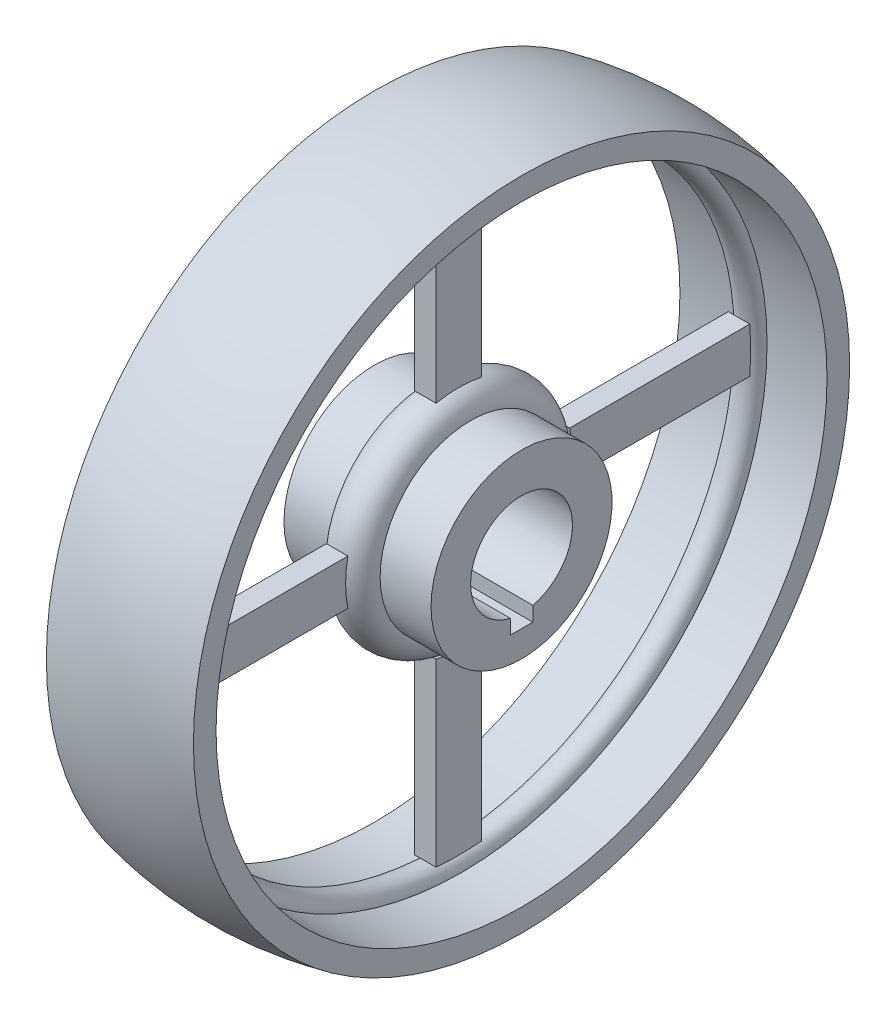
from build123d import *

# Parameters (mm, degrees)
SKETCH2_R               = 129
SKETCH2_R_2             = 50
BOSS_EXTRUDE1_DEPTH     = 4.75
CUT_EXTRUDE5_DEPTH      = 160
CUT_EXTRUDE5_DEPTH_BACK = 138
SKETCH6_R               = 22.5
CUT_EXTRUDE6_DEPTH      = 138
SKETCH7_W               = 9.947014286
SKETCH7_H               = 11.780873212
CUT_EXTRUDE7_DEPTH      = 138


with BuildPart() as part:
    # Sketch1 → Revolve1 (revolve)
    with BuildSketch(Plane.XY, mode=Mode.PRIVATE) as revolve1_sk:
        with BuildLine():
            Line((-32.5, 10), (32.5, 10))
            Line((32.5, 10), (32.5, 40))
            Line((32.5, 40), (10, 40))
            ThreePointArc((10, 40), (0, 50), (-10, 40))
            Line((-10, 40), (-32.5, 40))
            Line((-32.5, 40), (-32.5, 10))
        make_face()
        with BuildLine():
            Line((-32.5, 135), (-6, 135))
            ThreePointArc((-6, 135), (0, 129), (6, 135))
            Line((6, 135), (32.5, 135))
            Line((32.5, 135), (32.5, 145))
            ThreePointArc((32.5, 145), (0, 148.597611017), (-32.5, 145))
            Line((-32.5, 145), (-32.5, 135))
        make_face()
    revolve(revolve1_sk.sketch.rotate(Axis((-46.335135684, 0, 0), (1, 0, 0)), 90), axis=Axis((-46.335135684, 0, 0), (1, 0, 0)))

    # Sketch6 → Cut-Extrude6 (cut)
    with BuildSketch(Plane(origin=(32.5, 0, 0), x_dir=(0, 0, -1), z_dir=(1, 0, 0))):
        Circle(SKETCH6_R)
    extrude(amount=-CUT_EXTRUDE6_DEPTH, mode=Mode.SUBTRACT)

    # Sketch7 → Cut-Extrude7 (cut)
    with BuildSketch(Plane(origin=(32.5, 0, 0), x_dir=(0, 0, -1), z_dir=(1, 0, 0))):
        with Locations((0, -22.5)):
            Rectangle(SKETCH7_W, SKETCH7_H)
    extrude(amount=-CUT_EXTRUDE7_DEPTH, mode=Mode.SUBTRACT)


with BuildPart() as body_2:
    # Sketch2 → Boss-Extrude1 (new, symmetric)
    with BuildSketch(Plane(origin=(0, 0, 0), x_dir=(0, 0, -1), z_dir=(1, 0, 0))):
        Circle(SKETCH2_R)
        Circle(SKETCH2_R_2, mode=Mode.SUBTRACT)
    extrude(amount=BOSS_EXTRUDE1_DEPTH, both=True)

    # Sketch3 → Cut-Extrude5 (cut, two sides: drawn at the far end of the back side and taken through both)
    with BuildSketch(Plane(origin=(4.75, 0, 0), x_dir=(0, 0, -1), z_dir=(1, 0, 0)).offset(-CUT_EXTRUDE5_DEPTH_BACK)):
        with BuildLine():
            Line((48.989794856, 10), (128.611819053, 10))
            ThreePointArc((128.611819053, 10), (91.216774773, 91.216774773), (10, 128.611819053))
            Line((10, 128.611819053), (10, 48.989794856))
            ThreePointArc((10, 48.989794856), (35.355339059, 35.355339059), (48.989794856, 10))
        make_face()
        with BuildLine():
            Line((-10, 48.989794856), (-10, 128.611819053))
            ThreePointArc((-10, 128.611819053), (-91.216774773, 91.216774773), (-128.611819053, 10))
            Line((-128.611819053, 10), (-48.989794856, 10))
            ThreePointArc((-48.989794856, 10), (-35.355339059, 35.355339059), (-10, 48.989794856))
        make_face()
        with BuildLine():
            Line((48.989794856, -10), (128.611819053, -10))
            ThreePointArc((128.611819053, -10), (91.216774773, -91.216774773), (10, -128.611819053))
            Line((10, -128.611819053), (10, -48.989794856))
            ThreePointArc((10, -48.989794856), (35.355339059, -35.355339059), (48.989794856, -10))
        make_face()
        with BuildLine():
            Line((-10, -48.989794856), (-10, -128.611819053))
            ThreePointArc((-10, -128.611819053), (-91.216774773, -91.216774773), (-128.611819053, -10))
            Line((-128.611819053, -10), (-48.989794856, -10))
            ThreePointArc((-48.989794856, -10), (-35.355339059, -35.355339059), (-10, -48.989794856))
        make_face()
    extrude(amount=CUT_EXTRUDE5_DEPTH + CUT_EXTRUDE5_DEPTH_BACK, mode=Mode.SUBTRACT)


with BuildPart() as cut_extrude5_piece_1:
    # of the separate pieces the step leaves, piece 1, a body of its own (cut_extrude5_pieces)
    add(body_2.part.solids().sort_by_distance((4.75, 10, -128.611819053))[0])


with BuildPart() as cut_extrude5_piece_2:
    # of the separate pieces the step leaves, piece 2, a body of its own (cut_extrude5_pieces)
    add(body_2.part.solids().sort_by_distance((4.75, 128.611819053, -10))[0])


with BuildPart() as cut_extrude5_piece_3:
    # of the separate pieces the step leaves, piece 3, a body of its own (cut_extrude5_pieces)
    add(body_2.part.solids().sort_by_distance((-4.75, -128.611819053, 10))[0])


with BuildPart() as cut_extrude5_piece_4:
    # of the separate pieces the step leaves, piece 4, a body of its own (cut_extrude5_pieces)
    add(body_2.part.solids().sort_by_distance((4.75, 10, 128.611819053))[0])


solid = Compound([part.part, cut_extrude5_piece_1.part, cut_extrude5_piece_2.part, cut_extrude5_piece_3.part, cut_extrude5_piece_4.part])
